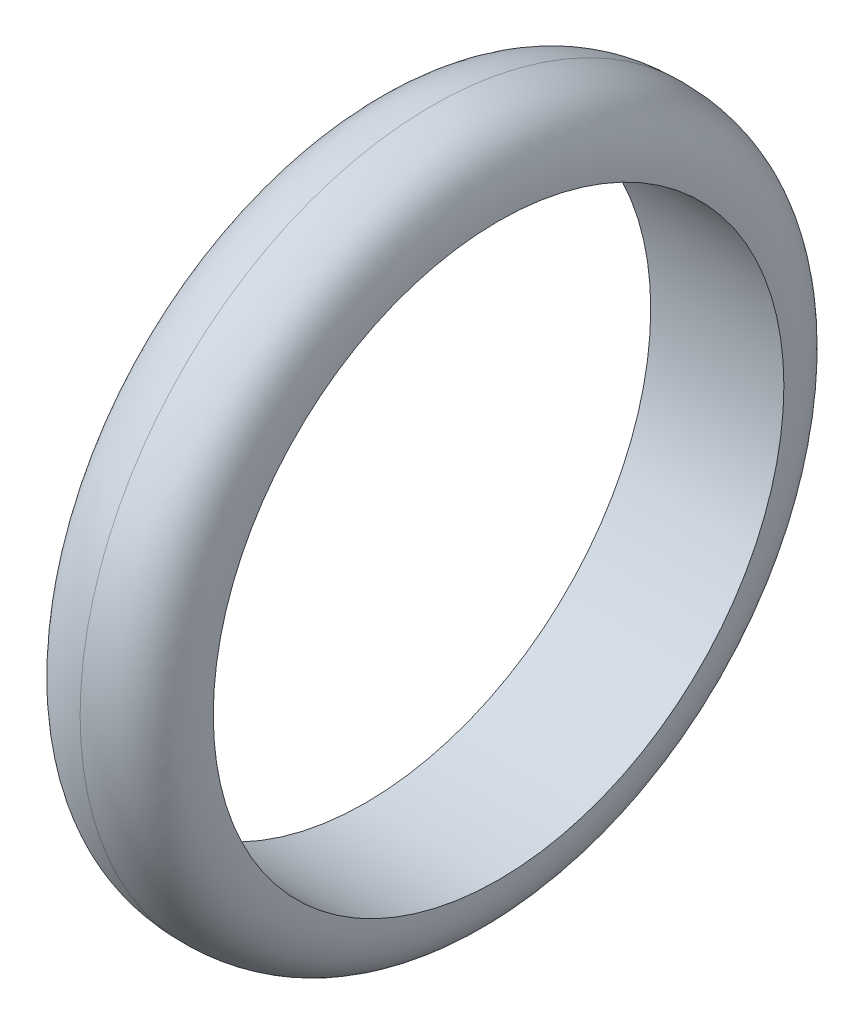
from build123d import *


with BuildPart() as part:
    # Sketch1 → Revolve1 (revolve)
    with BuildSketch(Plane.XY, mode=Mode.PRIVATE) as revolve1_sk:
        with BuildLine():
            Line((-8.89, 38.1), (8.89, 38.1))
            add(Edge.make_bspline(
                [(8.89, 38.1), (8.89, 46.99), (0, 46.99)],
                knots=[0, 0, 0, 1, 1, 1], degree=2))
            add(Edge.make_bspline(
                [(-8.89, 38.1), (-8.89, 46.99), (0, 46.99)],
                knots=[0, 0, 0, 1, 1, 1], degree=2))
        make_face()
    revolve(revolve1_sk.sketch.rotate(Axis((0, 0, 0), (1, 0, 0)), 90), axis=Axis((0, 0, 0), (1, 0, 0)))


solid = part.part
